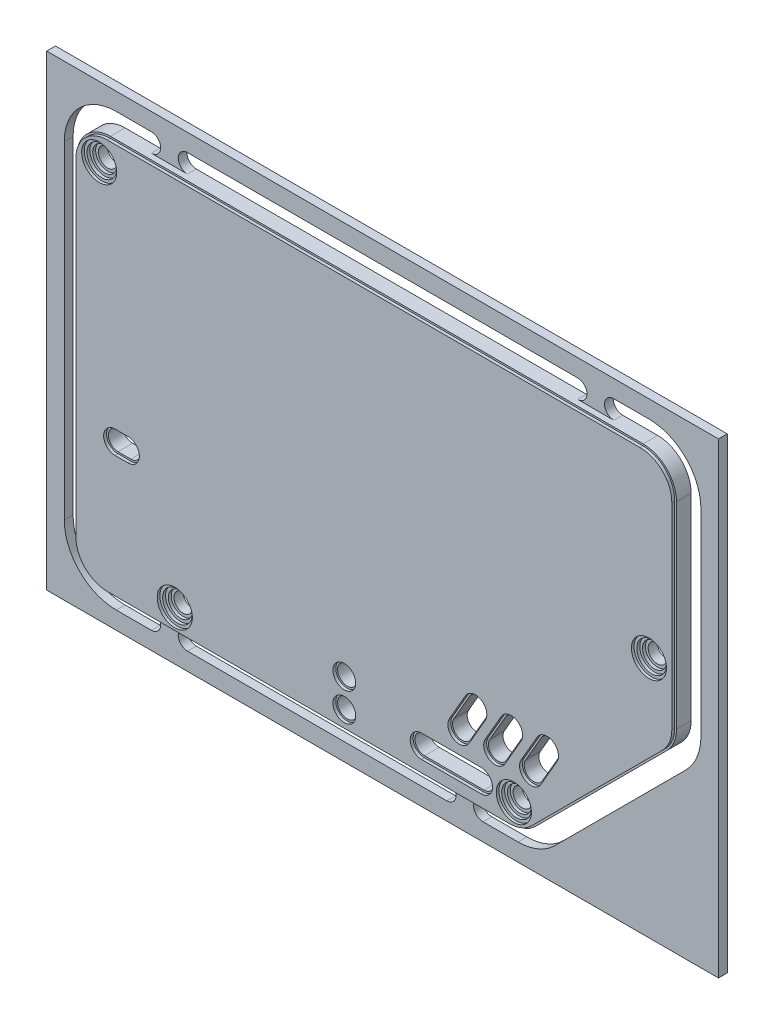
from build123d import *

# Parameters (mm, degrees)
BOSS_EXTRUDE1_DEPTH = 3
CUT_EXTRUDE1_DEPTH  = 121.966441627
SKETCH8_R           = 1
CUT_EXTRUDE2_DEPTH  = 10
SKETCH10_R          = 1
CUT_EXTRUDE4_DEPTH  = 10
SKETCH12_R          = 1.65
CUT_EXTRUDE5_DEPTH  = 10
SKETCH13_R          = 1.95
SKETCH13_R_2        = 1.65
CUT_EXTRUDE6_DEPTH  = 0.5
SKETCH15_W          = 114.75
SKETCH15_H          = 79.75
BOSS_EXTRUDE2_DEPTH = 1.5


with BuildPart() as part:
    # Sketch2 → Boss-Extrude1 (new body)
    with BuildSketch(Plane.XY.offset(8.62)):
        with BuildLine():
            Line((4.5, 66.2), (95.5, 66.2))
            ThreePointArc((95.5, 66.2), (99.530508653, 64.530508653), (101.2, 60.5))
            Line((101.2, 60.5), (101.2, 26.863961031))
            ThreePointArc((101.2, 26.863961031), (100.766113335, 24.682665466), (99.530508653, 22.833452378))
            Line((99.530508653, 22.833452378), (77.166547622, 0.469491347))
            ThreePointArc((77.166547622, 0.469491347), (75.317334534, -0.766113335), (73.136038969, -1.2))
            Line((73.136038969, -1.2), (4.5, -1.2))
            ThreePointArc((4.5, -1.2), (0.469491347, 0.469491347), (-1.2, 4.5))
            Line((-1.2, 4.5), (-1.2, 60.5))
            ThreePointArc((-1.2, 60.5), (0.469491347, 64.530508653), (4.5, 66.2))
        make_face()
    extrude(amount=BOSS_EXTRUDE1_DEPTH)

    # Sketch6 → Cut-Extrude1 (cut, through all)
    with BuildSketch(Plane.XY.offset(11.62)):
        with BuildLine():
            Line((68.326, 1.398), (58.166, 1.398))
            ThreePointArc((58.166, 1.398), (56.516, 3.048), (58.166, 4.698))
            Line((58.166, 4.698), (68.326, 4.698))
            ThreePointArc((68.326, 4.698), (69.976, 3.048), (68.326, 1.398))
        make_face()
    extrude(amount=-CUT_EXTRUDE1_DEPTH, mode=Mode.SUBTRACT)

    # Sketch8 → Cut-Extrude2 (cut)
    with BuildSketch(Plane.XY.offset(11.62)):
        with Locations((44.958, 2.539999994)):
            Circle(SKETCH8_R)
        with Locations((44.958000001, 6.095999994)):
            Circle(SKETCH8_R)
    extrude(amount=-CUT_EXTRUDE2_DEPTH, mode=Mode.SUBTRACT)

    # Sketch10 → Cut-Extrude4 (cut)
    with BuildSketch(Plane.XY.offset(11.62)):
        with Locations((5.147878003, 21.843999999)):
            Circle(SKETCH10_R)
        with Locations((8.647878003, 21.843999999)):
            Circle(SKETCH10_R)
    extrude(amount=-CUT_EXTRUDE4_DEPTH, mode=Mode.SUBTRACT)

    # Sketch12 → Cut-Extrude5 (cut)
    with BuildSketch(Plane.XY.offset(11.62)):
        with Locations((44.958000001, 6.745999994)):
            Circle(SKETCH12_R)
        with Locations((44.958000001, 1.889999994)):
            Circle(SKETCH12_R)
        with BuildLine():
            Line((5.797878003, 23.493999999), (7.997878003, 23.493999999))
            ThreePointArc((7.997878003, 23.493999999), (9.647878003, 21.843999999), (7.997878003, 20.193999999))
            Line((7.997878003, 20.193999999), (5.797878003, 20.193999999))
            ThreePointArc((5.797878003, 20.193999999), (4.147878003, 21.843999999), (5.797878003, 23.493999999))
        make_face()
        with BuildLine():
            Line((69.29017176, 9.365911087), (72.03961641, 14.128088914))
            ThreePointArc((72.03961641, 14.128088914), (74.293558327, 14.73203083), (74.897500243, 12.478088914))
            Line((74.897500243, 12.478088914), (72.148055593, 7.715911087))
            ThreePointArc((72.148055593, 7.715911087), (69.894113677, 7.111969171), (69.29017176, 9.365911087))
        make_face()
        with BuildLine():
            Line((63.170258907, 9.365911087), (65.919703557, 14.128088914))
            ThreePointArc((65.919703557, 14.128088914), (68.173645473, 14.73203083), (68.777587389, 12.478088914))
            Line((68.777587389, 12.478088914), (66.028142739, 7.715911087))
            ThreePointArc((66.028142739, 7.715911087), (63.774200823, 7.111969171), (63.170258907, 9.365911087))
        make_face()
        with BuildLine():
            Line((75.410084614, 9.365911087), (78.159529264, 14.128088914))
            ThreePointArc((78.159529264, 14.128088914), (80.41347118, 14.73203083), (81.017413096, 12.478088914))
            Line((81.017413096, 12.478088914), (78.267968446, 7.715911087))
            ThreePointArc((78.267968446, 7.715911087), (76.01402653, 7.111969171), (75.410084614, 9.365911087))
        make_face()
    extrude(amount=-CUT_EXTRUDE5_DEPTH, mode=Mode.SUBTRACT)

    # Sketch13 → Cut-Extrude6 (cut)
    # profile 1 of 8: a face of its own
    with BuildSketch(Plane.XY.offset(11.62)):
        with BuildLine():
            Line((-1.2, 60.5), (-1.2, 4.5))
            ThreePointArc((-1.2, 4.5), (0.469491347, 0.469491347), (4.5, -1.2))
            Line((4.5, -1.2), (73.136038969, -1.2))
            ThreePointArc((73.136038969, -1.2), (75.317334534, -0.766113335), (77.166547622, 0.469491347))
            Line((77.166547622, 0.469491347), (99.530508653, 22.833452378))
            ThreePointArc((99.530508653, 22.833452378), (100.766113335, 24.682665466), (101.2, 26.863961031))
            Line((101.2, 26.863961031), (101.2, 60.5))
            ThreePointArc((101.2, 60.5), (99.530508653, 64.530508653), (95.5, 66.2))
            Line((95.5, 66.2), (4.5, 66.2))
            ThreePointArc((4.5, 66.2), (0.469491347, 64.530508653), (-1.2, 60.5))
        make_face()
        with BuildLine():
            ThreePointArc((100.9, 60.5), (99.318376618, 64.318376618), (95.5, 65.9))
            Line((95.5, 65.9), (4.5, 65.9))
            ThreePointArc((4.5, 65.9), (0.681623382, 64.318376618), (-0.9, 60.5))
            Line((-0.9, 60.5), (-0.9, 4.5))
            ThreePointArc((-0.9, 4.5), (0.681623382, 0.681623382), (4.5, -0.9))
            Line((4.5, -0.9), (73.136038969, -0.9))
            ThreePointArc((73.136038969, -0.9), (75.202529504, -0.488949476), (76.954415588, 0.681623382))
            Line((76.954415588, 0.681623382), (99.318376618, 23.045584412))
            ThreePointArc((99.318376618, 23.045584412), (100.488949476, 24.797470496), (100.9, 26.863961031))
            Line((100.9, 26.863961031), (100.9, 60.5))
        make_face(mode=Mode.SUBTRACT)
    # profile 2 of 8: a face of its own
    with BuildSketch(Plane.XY.offset(11.62)):
        with BuildLine():
            Line((5.797878003, 19.893999999), (7.997878003, 19.893999999))
            ThreePointArc((7.997878003, 19.893999999), (9.947878003, 21.843999999), (7.997878003, 23.793999999))
            Line((7.997878003, 23.793999999), (5.797878003, 23.793999999))
            ThreePointArc((5.797878003, 23.793999999), (3.847878003, 21.843999999), (5.797878003, 19.893999999))
        make_face()
        with BuildLine():
            ThreePointArc((7.997878003, 23.493999999), (9.647878003, 21.843999999), (7.997878003, 20.193999999))
            Line((7.997878003, 20.193999999), (5.797878003, 20.193999999))
            ThreePointArc((5.797878003, 20.193999999), (4.147878003, 21.843999999), (5.797878003, 23.493999999))
            Line((5.797878003, 23.493999999), (7.997878003, 23.493999999))
        make_face(mode=Mode.SUBTRACT)
    # profile 3 of 8: a face of its own
    with BuildSketch(Plane.XY.offset(11.62)):
        with Locations((44.958000001, 6.745999994)):
            Circle(SKETCH13_R)
        with Locations((44.958000001, 6.745999994)):
            Circle(SKETCH13_R_2, mode=Mode.SUBTRACT)
    # profile 4 of 8: a face of its own
    with BuildSketch(Plane.XY.offset(11.62)):
        with Locations((44.958000001, 1.889999994)):
            Circle(SKETCH13_R)
        with Locations((44.958000001, 1.889999994)):
            Circle(SKETCH13_R_2, mode=Mode.SUBTRACT)
    # profile 5 of 8: a face of its own
    with BuildSketch(Plane.XY.offset(11.62)):
        with BuildLine():
            Line((68.326, 4.998), (58.166, 4.998))
            ThreePointArc((58.166, 4.998), (56.216, 3.048), (58.166, 1.098))
            Line((58.166, 1.098), (68.326, 1.098))
            ThreePointArc((68.326, 1.098), (70.276, 3.048), (68.326, 4.998))
        make_face()
        with BuildLine():
            ThreePointArc((58.166, 1.398), (56.516, 3.048), (58.166, 4.698))
            Line((58.166, 4.698), (68.326, 4.698))
            ThreePointArc((68.326, 4.698), (69.976, 3.048), (68.326, 1.398))
            Line((68.326, 1.398), (58.166, 1.398))
        make_face(mode=Mode.SUBTRACT)
    # profile 6 of 8: a face of its own
    with BuildSketch(Plane.XY.offset(11.62)):
        with BuildLine():
            Line((65.659895936, 14.278088914), (62.910451286, 9.515911087))
            ThreePointArc((62.910451286, 9.515911087), (63.624200823, 6.85216155), (66.287950361, 7.565911087))
            Line((66.287950361, 7.565911087), (69.037395011, 12.328088914))
            ThreePointArc((69.037395011, 12.328088914), (68.323645473, 14.991838451), (65.659895936, 14.278088914))
        make_face()
        with BuildLine():
            ThreePointArc((65.919703557, 14.128088914), (68.173645473, 14.73203083), (68.777587389, 12.478088914))
            Line((68.777587389, 12.478088914), (66.028142739, 7.715911087))
            ThreePointArc((66.028142739, 7.715911087), (63.774200823, 7.111969171), (63.170258907, 9.365911087))
            Line((63.170258907, 9.365911087), (65.919703557, 14.128088914))
        make_face(mode=Mode.SUBTRACT)
    # profile 7 of 8: a face of its own
    with BuildSketch(Plane.XY.offset(11.62)):
        with BuildLine():
            Line((72.407863214, 7.565911087), (75.157307864, 12.328088914))
            ThreePointArc((75.157307864, 12.328088914), (74.443558327, 14.991838451), (71.779808789, 14.278088914))
            Line((71.779808789, 14.278088914), (69.030364139, 9.515911087))
            ThreePointArc((69.030364139, 9.515911087), (69.744113677, 6.85216155), (72.407863214, 7.565911087))
        make_face()
        with BuildLine():
            ThreePointArc((72.03961641, 14.128088914), (74.293558327, 14.73203083), (74.897500243, 12.478088914))
            Line((74.897500243, 12.478088914), (72.148055593, 7.715911087))
            ThreePointArc((72.148055593, 7.715911087), (69.894113677, 7.111969171), (69.29017176, 9.365911087))
            Line((69.29017176, 9.365911087), (72.03961641, 14.128088914))
        make_face(mode=Mode.SUBTRACT)
    # profile 8 of 8: a face of its own
    with BuildSketch(Plane.XY.offset(11.62)):
        with BuildLine():
            Line((78.527776067, 7.565911087), (81.277220717, 12.328088914))
            ThreePointArc((81.277220717, 12.328088914), (80.56347118, 14.991838451), (77.899721643, 14.278088914))
            Line((77.899721643, 14.278088914), (75.150276993, 9.515911087))
            ThreePointArc((75.150276993, 9.515911087), (75.86402653, 6.85216155), (78.527776067, 7.565911087))
        make_face()
        with BuildLine():
            ThreePointArc((78.159529264, 14.128088914), (80.41347118, 14.73203083), (81.017413096, 12.478088914))
            Line((81.017413096, 12.478088914), (78.267968446, 7.715911087))
            ThreePointArc((78.267968446, 7.715911087), (76.01402653, 7.111969171), (75.410084614, 9.365911087))
            Line((75.410084614, 9.365911087), (78.159529264, 14.128088914))
        make_face(mode=Mode.SUBTRACT)
    extrude(amount=-CUT_EXTRUDE6_DEPTH, mode=Mode.SUBTRACT)

    # Sketch14 → Cut-Revolve1 (revolve, cut)
    with BuildSketch(Plane(origin=(0, 2.5, 0), x_dir=(-1, 0, 0), z_dir=(0, -1, 0))):
        Polygon((-16, -11.62), (-16, -8.62), (-17.5875, -8.62), (-17.5875, -9.92), (-17.5875, -10.17), (-18.058333333, -10.17), (-18.058333333, -10.67), (-18.529166667, -10.67), (-18.529166667, -11.17), (-19, -11.17), (-19, -11.42), (-19, -11.62), align=None)
    cut_revolve1 = revolve(axis=Axis((16, 2.5, 11.62), (0, 0, -1)), mode=Mode.SUBTRACT)

    # Sketch-Pattern1: Cut-Revolve1 at 3 more places
    with Locations((-12.914214, 59.414214, 0), (57.917501, 0.15899, 0), (81, 33, 0)):
        add(cut_revolve1, mode=Mode.SUBTRACT)

    # Sketch15 → Boss-Extrude2 (add)
    # profile 1 of 5: a face of its own
    with BuildSketch(Plane(origin=(0, 0, 8.62), x_dir=(-1, 0, 0), z_dir=(0, 0, -1))):
        with Locations((-50, 32.5)):
            Rectangle(SKETCH15_W, SKETCH15_H)
        with BuildLine():
            ThreePointArc((-79.411611652, -1.775572683), (-76.532354432, -3.699430851), (-73.136038969, -4.375))
            Line((-73.136038969, -4.375), (-4.5, -4.375))
            ThreePointArc((-4.5, -4.375), (1.775572683, -1.775572683), (4.375, 4.5))
            Line((4.375, 4.5), (4.375, 60.5))
            ThreePointArc((4.375, 60.5), (1.775572683, 66.775572683), (-4.5, 69.375))
            Line((-4.5, 69.375), (-95.5, 69.375))
            ThreePointArc((-95.5, 69.375), (-101.775572683, 66.775572683), (-104.375, 60.5))
            Line((-104.375, 60.5), (-104.375, 26.863961031))
            ThreePointArc((-104.375, 26.863961031), (-103.699430851, 23.467645568), (-101.775572683, 20.588388348))
            Line((-101.775572683, 20.588388348), (-79.411611652, -1.775572683))
        make_face(mode=Mode.SUBTRACT)
    # profile 2 of 5: a face of its own
    with BuildSketch(Plane(origin=(0, 0, 8.62), x_dir=(-1, 0, 0), z_dir=(0, 0, -1))):
        with BuildLine():
            Line((-16.675, -4.375), (-10.5, -4.375))
            ThreePointArc((-10.5, -4.375), (-12.0875, -2.7875), (-10.5, -1.2))
            Line((-10.5, -1.2), (-16.675, -1.2))
            ThreePointArc((-16.675, -1.2), (-15.0875, -2.7875), (-16.675, -4.375))
        make_face()
    # profile 3 of 5: a face of its own
    with BuildSketch(Plane(origin=(0, 0, 8.62), x_dir=(-1, 0, 0), z_dir=(0, 0, -1))):
        with BuildLine():
            Line((-67.136038969, -4.375), (-60.961038969, -4.375))
            ThreePointArc((-60.961038969, -4.375), (-62.548538969, -2.7875), (-60.961038969, -1.2))
            Line((-60.961038969, -1.2), (-67.136038969, -1.2))
            ThreePointArc((-67.136038969, -1.2), (-65.548538969, -2.7875), (-67.136038969, -4.375))
        make_face()
    # profile 4 of 5: a face of its own
    with BuildSketch(Plane(origin=(0, 0, 8.62), x_dir=(-1, 0, 0), z_dir=(0, 0, -1))):
        with BuildLine():
            ThreePointArc((-10.5, 66.2), (-12.0875, 67.7875), (-10.5, 69.375))
            Line((-10.5, 69.375), (-16.675, 69.375))
            ThreePointArc((-16.675, 69.375), (-15.0875, 67.7875), (-16.675, 66.2))
            Line((-16.675, 66.2), (-10.5, 66.2))
        make_face()
    # profile 5 of 5: a face of its own
    with BuildSketch(Plane(origin=(0, 0, 8.62), x_dir=(-1, 0, 0), z_dir=(0, 0, -1))):
        with BuildLine():
            ThreePointArc((-83.325, 66.2), (-84.9125, 67.7875), (-83.325, 69.375))
            Line((-83.325, 69.375), (-89.5, 69.375))
            ThreePointArc((-89.5, 69.375), (-87.9125, 67.7875), (-89.5, 66.2))
            Line((-89.5, 66.2), (-83.325, 66.2))
        make_face()
    extrude(amount=-BOSS_EXTRUDE2_DEPTH)


solid = part.part
